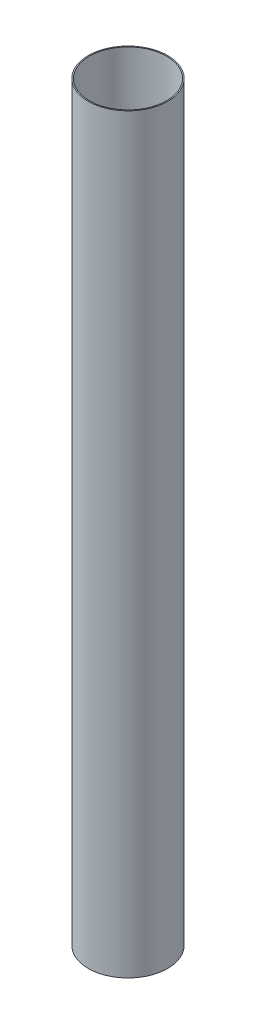
from build123d import *

# Parameters (mm, degrees)
SKETCH1_R      = 46.1137
SKETCH1_R_2    = 44.8437
EXTRUDE1_DEPTH = 871.66666662


with BuildPart() as part:
    # Sketch1 → Extrude1 (new body)
    with BuildSketch(Plane(origin=(0, 0, 0), x_dir=(1, 0, 0), z_dir=(0, 1, 0))):
        with Locations(Location((0, 0, 0), (0, 0, 270))):
            Circle(SKETCH1_R)
        with Locations(Location((0, 0, 0), (0, 0, 270))):
            Circle(SKETCH1_R_2, mode=Mode.SUBTRACT)
    extrude(amount=EXTRUDE1_DEPTH)


solid = part.part
